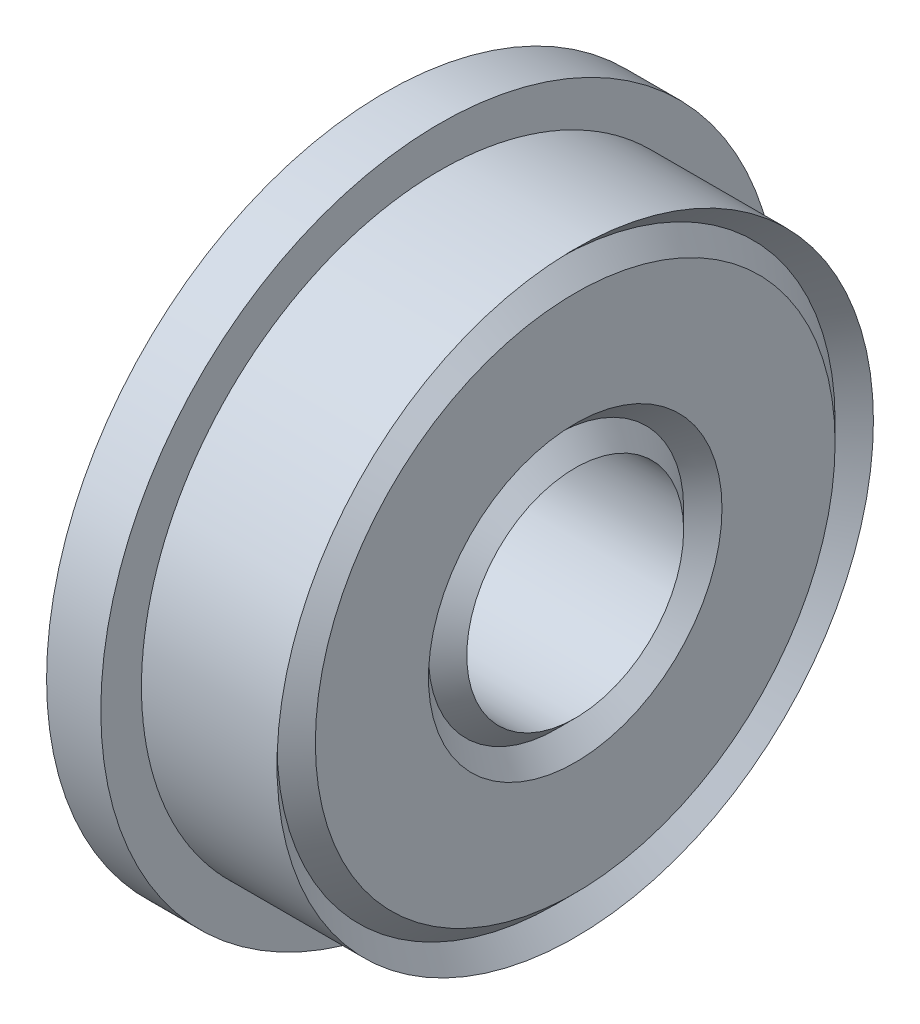
from build123d import *

# Parameters (mm, degrees)
SKETCH_2_R      = 12.5
SKETCH_2_R_2    = 11
EXTRUDE_1_DEPTH = 2


with BuildPart() as part:
    # 草图1 → 旋转1 (revolve)
    with BuildSketch(Plane(origin=(0, 0, 0), x_dir=(1, 0, 0), z_dir=(0, 1, 0)), mode=Mode.PRIVATE) as revolve_1_sk:
        Polygon((0, -4), (-7, -4), (-6.292893219, -4.707106781), (-7, -5.414213562), (-7, -9.585786438), (-6.292893219, -10.292893219), (-7, -11), (0, -11), (-0.707106781, -10.292893219), (0, -9.585786438), (0, -5.414213562), (-0.707106781, -4.707106781), align=None)
    revolve(revolve_1_sk.sketch.rotate(Axis((0, 0, 0), (-1, 0, 0)), 180), axis=Axis((0, 0, 0), (-1, 0, 0)))


with BuildPart() as body_2:
    # 草图2 → 凸台-拉伸1 (new body)
    with BuildSketch(Plane.ZY.offset(7)):
        Circle(SKETCH_2_R)
        Circle(SKETCH_2_R_2, mode=Mode.SUBTRACT)
    extrude(amount=-EXTRUDE_1_DEPTH)


solid = Compound([part.part, body_2.part])
